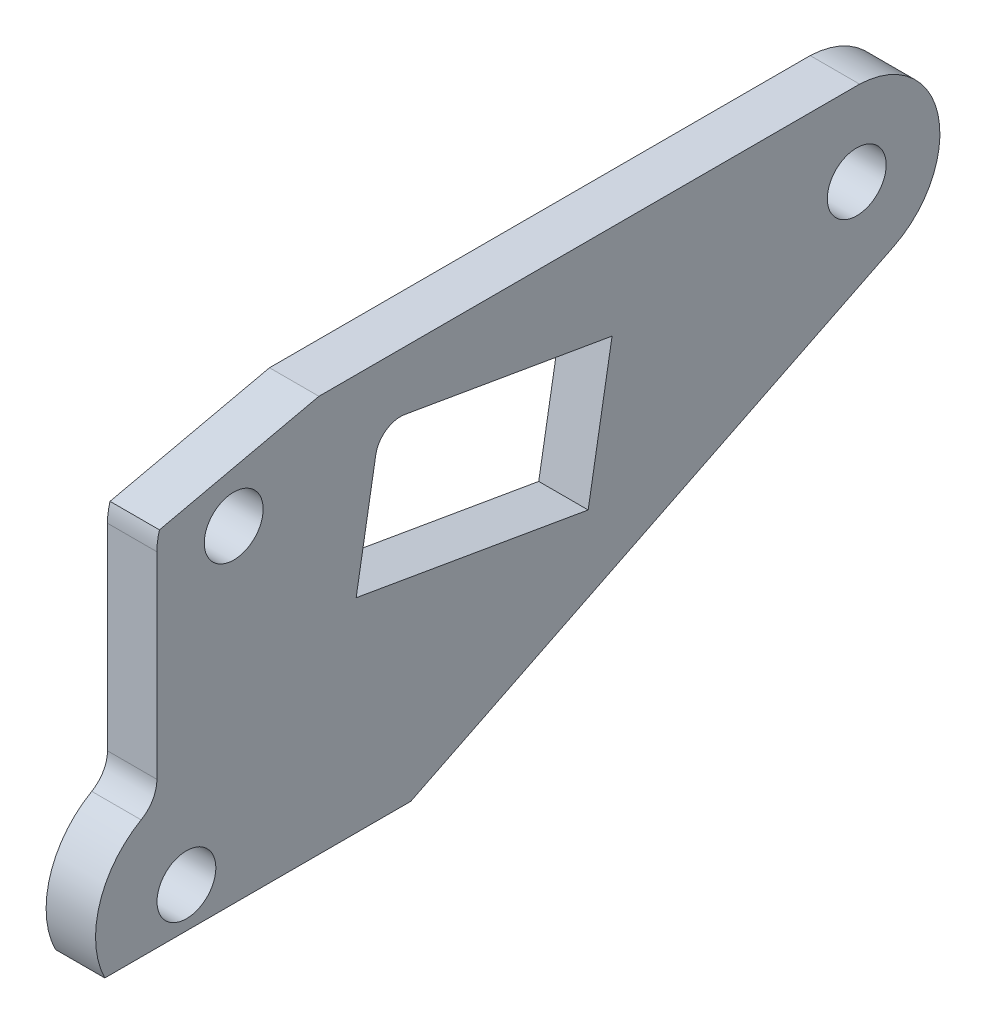
from build123d import *

# Parameters (mm, degrees)
SKETCH1_R           = 2.38125
BOSS_EXTRUDE1_DEPTH = 2


with BuildPart() as part:
    # Sketch1 → Boss-Extrude1 (new, symmetric)
    with BuildSketch(Plane(origin=(0, 0, 0), x_dir=(0, 0, -1), z_dir=(1, 0, 0))):
        with BuildLine():
            Line((-60.839919999, -25.371860345), (-36.087520647, -25.371860345))
            Line((-36.087520647, -25.371860345), (-26.022794648, -20.390042329))
            Line((-26.022794648, -20.390042329), (2.985497353, -6.031575768))
            ThreePointArc((2.985497353, -6.031575768), (6.578628627, 1.419417511), (0.23290188, 6.72598375))
            Line((0.23290188, 6.72598375), (-43.515144264, 6.72598375))
            Line((-43.515144264, 6.72598375), (-56.419454373, 3.818772093))
            ThreePointArc((-56.419454373, 3.818772093), (-56.573650174, 3.11024955), (-56.625400227, 2.386991318))
            Line((-56.625400227, 2.386991318), (-56.625400227, -13.559221537))
            ThreePointArc((-56.625400227, -13.559221537), (-56.966991368, -14.831463057), (-57.899887224, -15.761510537))
            ThreePointArc((-57.899887224, -15.761510537), (-61.267882579, -19.98604889), (-60.839919999, -25.371860345))
        make_face()
        with Locations((-54.236184525, -22.137211246)):
            Circle(SKETCH1_R, mode=Mode.SUBTRACT)
        with Locations((-50.410128911, 1.079375692)):
            Circle(SKETCH1_R, mode=Mode.SUBTRACT)
        with BuildLine():
            ThreePointArc((-38.916021454, 0.318688833), (-38.085451708, 1.633557707), (-36.568397511, 1.976008906))
            Line((-36.568397511, 1.976008906), (-19.797694446, -0.914638547))
            Line((-19.797694446, -0.914638547), (-21.730897843, -12.13052726))
            Line((-21.730897843, -12.13052726), (-40.504072916, -8.894727872))
            Line((-40.504072916, -8.894727872), (-38.916021454, 0.318688833))
        make_face(mode=Mode.SUBTRACT)
        Circle(SKETCH1_R, mode=Mode.SUBTRACT)
    extrude(amount=BOSS_EXTRUDE1_DEPTH, both=True)


solid = part.part
